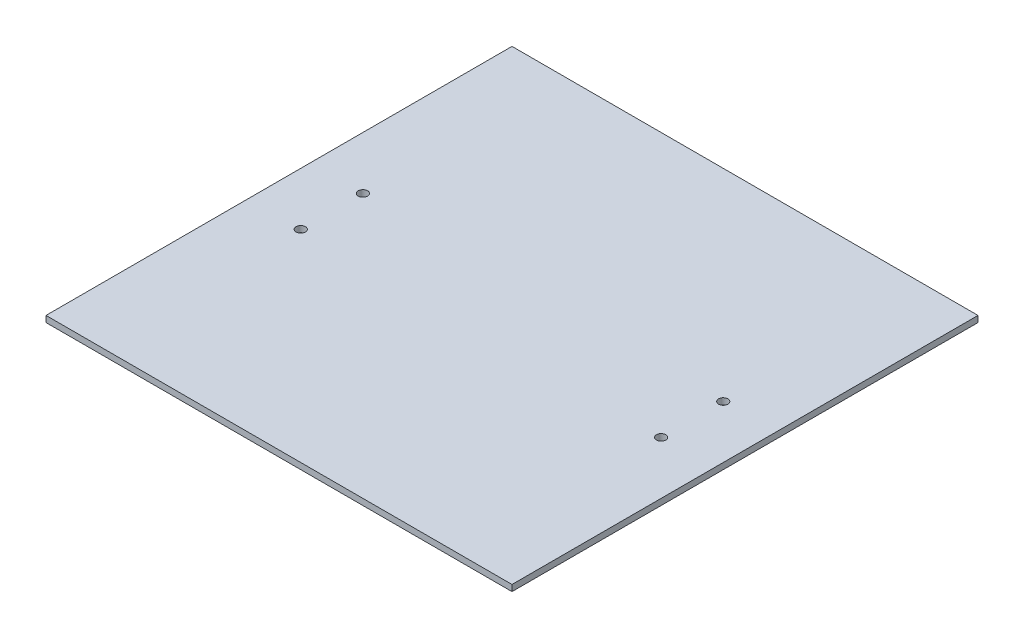
from build123d import *

# Parameters (mm, degrees)
SKETCH1_W           = 150
SKETCH1_H           = 150
SKETCH1_R           = 1.5
BOSS_EXTRUDE1_DEPTH = 2


with BuildPart() as part:
    # Sketch1 → Boss-Extrude1 (new body)
    with BuildSketch(Plane(origin=(0, 0, 0), x_dir=(1, 0, 0), z_dir=(0, 1, 0))):
        with Locations((75, 75)):
            Rectangle(SKETCH1_W, SKETCH1_H)
        with Locations(Location((17, 85, 0), (0, 0, 270))):
            Circle(SKETCH1_R, mode=Mode.SUBTRACT)
        with Locations(Location((17, 65, 0), (0, 0, 270))):
            Circle(SKETCH1_R, mode=Mode.SUBTRACT)
        with Locations(Location((133, 85, 0), (0, 0, 270))):
            Circle(SKETCH1_R, mode=Mode.SUBTRACT)
        with Locations(Location((133, 65, 0), (0, 0, 270))):
            Circle(SKETCH1_R, mode=Mode.SUBTRACT)
    extrude(amount=BOSS_EXTRUDE1_DEPTH)


solid = part.part
